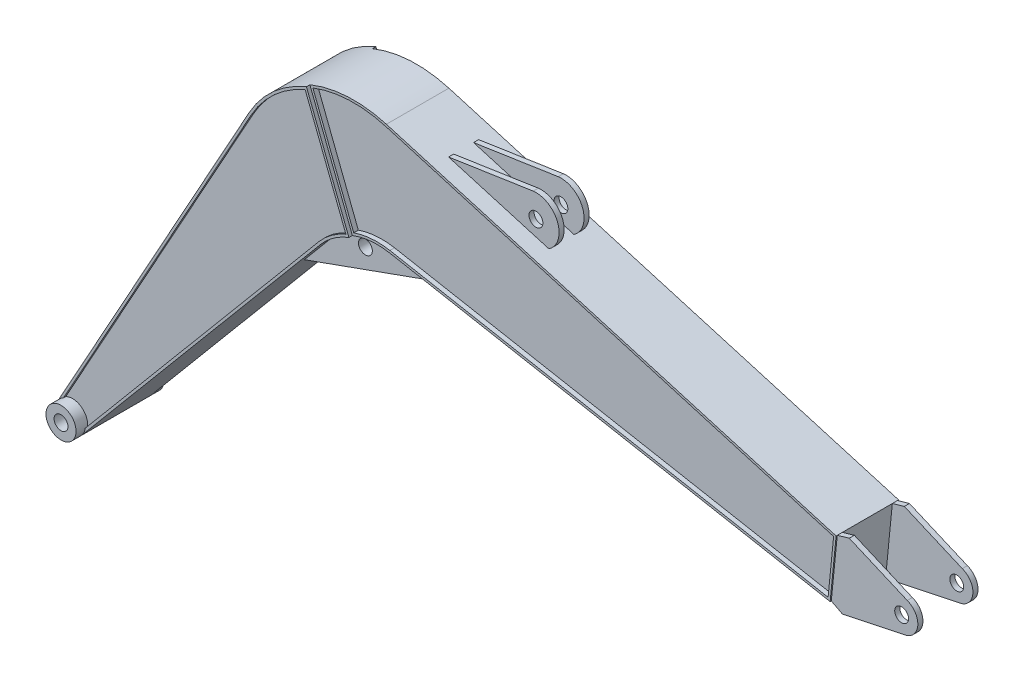
from build123d import *

# Parameters (mm, degrees)
BOSS_EXTRUDE1_DEPTH     = 140
BOSS_EXTRUDE2_DEPTH     = 190
BOSS_EXTRUDE3_DEPTH     = 115
SKETCH2_R               = 29.999999999999844
BOSS_EXTRUDE4_DEPTH     = 22
SKETCH4_R               = 30.000000000000057
BOSS_EXTRUDE5_DEPTH     = 22
SKETCH5_R               = 30.000000000000057
BOSS_EXTRUDE6_DEPTH     = 22
CUT_EXTRUDE1_DEPTH      = 4061.7139365889066
CUT_EXTRUDE1_DEPTH_BACK = 4061.7139365889066
SKETCH6_R               = 30
CUT_EXTRUDE2_DEPTH      = 105
CUT_EXTRUDE3_DEPTH      = 130
SKETCH9_R               = 30.000000000000057
BOSS_EXTRUDE8_DEPTH     = 40
BOSS_EXTRUDE9_START     = 10
BOSS_EXTRUDE9_DEPTH     = 10
BOSS_EXTRUDE10_START    = 20
BOSS_EXTRUDE10_DEPTH    = 20


with BuildPart() as part:
    # Sketch1 → Boss-Extrude1 (new, symmetric)
    with BuildSketch(Plane.XY):
        with BuildLine():
            ThreePointArc((65, -1.592e-14), (61.080020351084045, -22.23130931616846), (49.792888802733636, -41.781194629624984))
            Line((49.79288880273364, -41.78119462962495), (1081.4804368301984, 1187.7361471668223))
            ThreePointArc((1081.4804368301984, 1187.7361471668223), (1137.156074050822, 1239.1867098564549), (1203.951248641351, 1275.038371358024))
            Line((1203.9512486413507, 1275.0383713580243), (1020.4560106462599, 1747.3953623265181))
            ThreePointArc((1020.4560106462598, 1747.3953623265184), (878.0721607669617, 1658.3818553513138), (773.1873129694607, 1527.2493504832594))
            Line((773.1873129694607, 1527.2493504832594), (-49.792888802733614, 41.781194629624906))
            ThreePointArc((-49.792888802733636, 41.78119462962498), (22.23130931616842, 61.08002035108406), (65, 0))
        make_face()
    extrude(amount=BOSS_EXTRUDE1_DEPTH, both=True)

    # Sketch1<3> → Boss-Extrude2 (add, symmetric)
    with BuildSketch(Plane.XY):
        with BuildLine():
            ThreePointArc((-49.792888802733636, 41.78119462962498), (-41.78119462962498, -49.792888802733636), (49.792888802733636, -41.781194629624984))
            ThreePointArc((49.792888802733636, -41.781194629624984), (61.080020351084045, -22.23130931616846), (65, -1.592e-14))
            ThreePointArc((65, 0), (22.23130931616842, 61.08002035108406), (-49.792888802733636, 41.78119462962498))
        make_face()
    extrude(amount=BOSS_EXTRUDE2_DEPTH, both=True)

    # Sketch1<4> → Boss-Extrude3 (add, symmetric)
    with BuildSketch(Plane.XY):
        with BuildLine():
            Line((1020.4560106462599, 1747.3953623265181), (1203.9512486413507, 1275.0383713580243))
            ThreePointArc((1203.951248641351, 1275.038371358024), (1283.9508361288626, 1293.6512056471731), (1366.0000412931197, 1289.8697336638038))
            Line((1366.0000412931197, 1289.8697336638038), (3268.576248845471, 937.0104710473246))
            Line((3268.576248845471, 937.0104710473246), (3294.3538500413274, 1195.729460061636))
            Line((3294.3538500413274, 1195.729460061636), (1351.066804500354, 1764.790142245739))
            ThreePointArc((1351.066804500354, 1764.790142245739), (1184.2799206207571, 1784.2503708211993), (1020.4560106462598, 1747.3953623265184))
        make_face()
    extrude(amount=BOSS_EXTRUDE3_DEPTH, both=True)

    # Sketch2 → Boss-Extrude4 (add)
    with BuildSketch(Plane.XY.offset(130)):
        with BuildLine():
            Line((3316.347008179312, 912.1517793547129), (3583.220413673133, 968.2166417593702))
            ThreePointArc((3583.220413673133, 968.2166417593702), (3642.083328680258, 1030.4395755142295), (3596.6549667093313, 1103.0536249594716))
            Line((3596.6549667093313, 1103.0536249594716), (3346.0903941745296, 1210.6736897558415))
            Line((3346.0903941745296, 1210.6736897558415), (3294.3538500413274, 1195.7294600616358))
            Line((3294.3538500413274, 1195.7294600616358), (3268.5762488454716, 937.0104710473244))
            Line((3268.5762488454716, 937.0104710473244), (3316.347008179312, 912.1517793547129))
        make_face()
        with Locations((3572.428216253328, 1037.3796989131135)):
            Circle(SKETCH2_R, mode=Mode.SUBTRACT)
    boss_extrude4 = extrude(amount=-BOSS_EXTRUDE4_DEPTH)

    # Mirror1: Boss-Extrude4 across plane
    add(boss_extrude4.mirror(Plane.XY))

    # Sketch4 → Boss-Extrude5 (add)
    with BuildSketch(Plane.XY.offset(105)):
        with BuildLine():
            Line((1081.4804368301984, 1187.7361471668223), (966.4282906591733, 1050.6223386318286))
            Line((966.4282906591733, 1050.6223386318286), (1541.9882734825221, 1257.2302642995674))
            Line((1541.9882734825221, 1257.2302642995674), (1366.0000412931197, 1289.8697336638038))
            ThreePointArc((1366.0000412931197, 1289.8697336638038), (1209.9357996231295, 1277.2587881300008), (1081.4804368301984, 1187.7361471668223))
        make_face()
        with Locations((1230.36579926459, 1230.3657992645947)):
            Circle(SKETCH4_R, mode=Mode.SUBTRACT)
    boss_extrude5 = extrude(amount=-BOSS_EXTRUDE5_DEPTH)

    # Mirror2: Boss-Extrude5 across plane
    add(boss_extrude5.mirror(Plane.XY))

    # Sketch5 → Boss-Extrude6 (add)
    with BuildSketch(Plane.XY.offset(65)):
        with BuildLine():
            Line((1549.7725074062366, 1706.602339723742), (1915.617102975737, 1761.8991017680858))
            ThreePointArc((1915.617102975737, 1761.8991017680858), (2020.9777520024375, 1697.3330400459488), (1983.1632899241847, 1579.6907468543984))
            Line((1983.1632899241847, 1579.6907468543984), (1549.7725074062366, 1706.602339723742))
        make_face()
        with Locations((1927.2132062202722, 1662.5737254056373)):
            Circle(SKETCH5_R, mode=Mode.SUBTRACT)
    boss_extrude6 = extrude(amount=-BOSS_EXTRUDE6_DEPTH)

    # Mirror3: Boss-Extrude6 across plane
    add(boss_extrude6.mirror(Plane.XY))

    # Sketch6 → Cut-Extrude1 (cut, two sides: drawn at the far end of the back side and taken through both)
    with BuildSketch(Plane.XY.offset(-CUT_EXTRUDE1_DEPTH_BACK)):
        Circle(SKETCH6_R)
    extrude(amount=CUT_EXTRUDE1_DEPTH + CUT_EXTRUDE1_DEPTH_BACK, mode=Mode.SUBTRACT)

    # Sketch7 → Cut-Extrude2 (cut, symmetric)
    with BuildSketch(Plane.XY):
        with BuildLine():
            Line((1024.0699284450966, 1738.0923452252694), (1200.3301627751682, 1284.3598406368847))
            ThreePointArc((1200.3301627751682, 1284.3598406368847), (1283.0164749646392, 1303.6074841841842), (1367.8235836773604, 1299.702062643902))
            Line((1367.8235836773604, 1299.702062643902), (3259.704029255034, 948.8264780890555))
            Line((3259.704029255034, 948.8264780890555), (3283.580471521982, 1188.4643310307968))
            Line((3283.580471521982, 1188.4643310307968), (1352.6744523210061, 1753.8994267060289))
            ThreePointArc((1352.6744523210061, 1753.8994267060289), (1213.394373329098, 1774.9543699676724), (1073.8793026905835, 1755.51739220688))
            ThreePointArc((1073.8793026905835, 1755.51739220688), (1048.7398871235857, 1747.4758383231158), (1024.0699284450966, 1738.0923452252696))
        make_face()
    extrude(amount=CUT_EXTRUDE2_DEPTH, both=True, mode=Mode.SUBTRACT)

    # Sketch7<3> → Cut-Extrude3 (cut, symmetric)
    with BuildSketch(Plane.XY):
        with BuildLine():
            ThreePointArc((1073.8199923990087, 1194.1640232636878), (1131.3327348933467, 1247.316238388219), (1200.3301627751682, 1284.3598406368847))
            Line((1200.3301627751682, 1284.3598406368847), (1024.0699284450966, 1738.0923452252694))
            ThreePointArc((1024.0699284450966, 1738.0923452252696), (886.3572203673968, 1652.3914458778913), (784.1655123326112, 1526.4299877886158))
            Line((784.1655123326113, 1526.4299877886158), (-29.387821008213336, 57.97720221250097))
            ThreePointArc((-29.387821008213336, 57.97720221250086), (37.706877201397155, 52.94517363951841), (64.39926034060059, -8.816760606002008))
            Line((64.39926034060059, -8.816760606001992), (1073.8199923990087, 1194.1640232636878))
        make_face()
    extrude(amount=CUT_EXTRUDE3_DEPTH, both=True, mode=Mode.SUBTRACT)

    # Sketch9 → Boss-Extrude8 (add)
    with BuildSketch(Plane(origin=(0, 0, 82.99999999999999), x_dir=(-1, 0, 0), z_dir=(0, 0, -1))):
        with BuildLine():
            ThreePointArc((-1257.9248669828, 1188.6465257030486), (-1243.5553130328078, 1182.1367963041562), (-1227.8728186550686, 1180.4279874615074))
            Line((-1227.8728186550686, 1180.4279874615074), (-1081.4804368301982, 1187.736147166822))
            ThreePointArc((-1081.4804368301982, 1187.736147166822), (-1209.9357996231292, 1277.258788130001), (-1366.00004129312, 1289.8697336638038))
            Line((-1366.0000412931197, 1289.8697336638038), (-1257.9248669827998, 1188.6465257030488))
        make_face()
        with Locations((-1230.36579926459, 1230.3657992645947)):
            Circle(SKETCH9_R, mode=Mode.SUBTRACT)
    boss_extrude8 = extrude(amount=BOSS_EXTRUDE8_DEPTH)

    # Mirror5: Boss-Extrude8 across plane
    add(boss_extrude8.mirror(Plane.XY))

    # Sketch10 → Boss-Extrude9 (add)
    with BuildSketch(Plane.XY.offset(140).offset(BOSS_EXTRUDE9_START)):
        with BuildLine():
            ThreePointArc((1081.4804368301982, 1187.736147166822), (1137.156074050822, 1239.186709856455), (1203.951248641351, 1275.0383713580243))
            Line((1203.951248641351, 1275.0383713580243), (1020.4560106462601, 1747.3953623265181))
            ThreePointArc((1020.4560106462601, 1747.3953623265181), (878.072160766962, 1658.3818553513136), (773.1873129694607, 1527.2493504832594))
            Line((773.1873129694607, 1527.2493504832594), (-49.7928888027335, 41.78119462962513))
            ThreePointArc((-49.79288880273354, 41.781194629625126), (-40.410071355387224, 50.91194489559906), (-29.387821008213336, 57.977202212500885))
            Line((-29.387821008213336, 57.97720221250097), (781.934579103123, 1522.4031834218724))
            ThreePointArc((781.9345791031229, 1522.4031834218724), (880.9305411746955, 1647.5021699961562), (1014.8653487547539, 1734.1706433119002))
            Line((1014.8653487547539, 1734.1706433119002), (1191.051052278277, 1280.6299973673715))
            ThreePointArc((1191.051052278277, 1280.6299973673717), (1127.3416356078974, 1244.4226736643095), (1073.9110640180447, 1194.2725581928576))
            Line((1073.9110640180447, 1194.2725581928576), (64.39926034060068, -8.816760606001935))
            ThreePointArc((64.3992603406006, -8.816760606001868), (59.42747856941116, -26.332010764128448), (49.79288880273364, -41.781194629624956))
            Line((49.79288880273365, -41.781194629624956), (1081.4804368301982, 1187.736147166822))
        make_face()
    boss_extrude9 = extrude(amount=-BOSS_EXTRUDE9_DEPTH)

    # Mirror6: Boss-Extrude9 across plane
    add(boss_extrude9.mirror(Plane.XY))

    # Sketch11 → Boss-Extrude10 (add)
    with BuildSketch(Plane.XY.offset(115).offset(BOSS_EXTRUDE10_START)):
        with BuildLine():
            Line((1024.0699284450966, 1738.0923452252691), (1200.3301627751687, 1284.359840636885))
            Line((1200.3301627751687, 1284.359840636885), (1203.951248641351, 1275.0383713580243))
            ThreePointArc((1203.951248641351, 1275.0383713580243), (1283.9508361288626, 1293.6512056471734), (1366.00004129312, 1289.8697336638038))
            Line((1366.00004129312, 1289.8697336638038), (3268.5762488454716, 937.0104710473244))
            Line((3268.5762488454716, 937.0104710473244), (3294.3538500413274, 1195.7294600616358))
            Line((3294.3538500413274, 1195.7294600616358), (1351.0668045003542, 1764.790142245739))
            ThreePointArc((1351.0668045003542, 1764.790142245739), (1184.2799206207574, 1784.2503708211993), (1020.4560106462601, 1747.3953623265181))
            Line((1020.4560106462601, 1747.3953623265181), (1024.0699284450966, 1738.0923452252691))
        make_face()
        with BuildLine():
            Line((3259.704029255035, 948.8264780890559), (1366.0372079275185, 1300.0333709128395))
            ThreePointArc((1366.0372079275185, 1300.0333709128395), (1287.0941128924526, 1303.959207285298), (1209.7241743097554, 1287.7939034326503))
            Line((1209.7241743097554, 1287.7939034326503), (1033.3612892265444, 1741.7906535753216))
            ThreePointArc((1033.3612892265444, 1741.7906535753216), (1191.085679257279, 1774.5620582834817), (1350.9138490858948, 1754.4149913418998))
            Line((1350.9138490858948, 1754.4149913418998), (3283.5804715219824, 1188.464331030797))
            Line((3283.5804715219824, 1188.464331030797), (3259.704029255035, 948.8264780890559))
        make_face(mode=Mode.SUBTRACT)
    boss_extrude10 = extrude(amount=-BOSS_EXTRUDE10_DEPTH)

    # Mirror7: Boss-Extrude10 across plane
    add(boss_extrude10.mirror(Plane.XY))


solid = part.part
